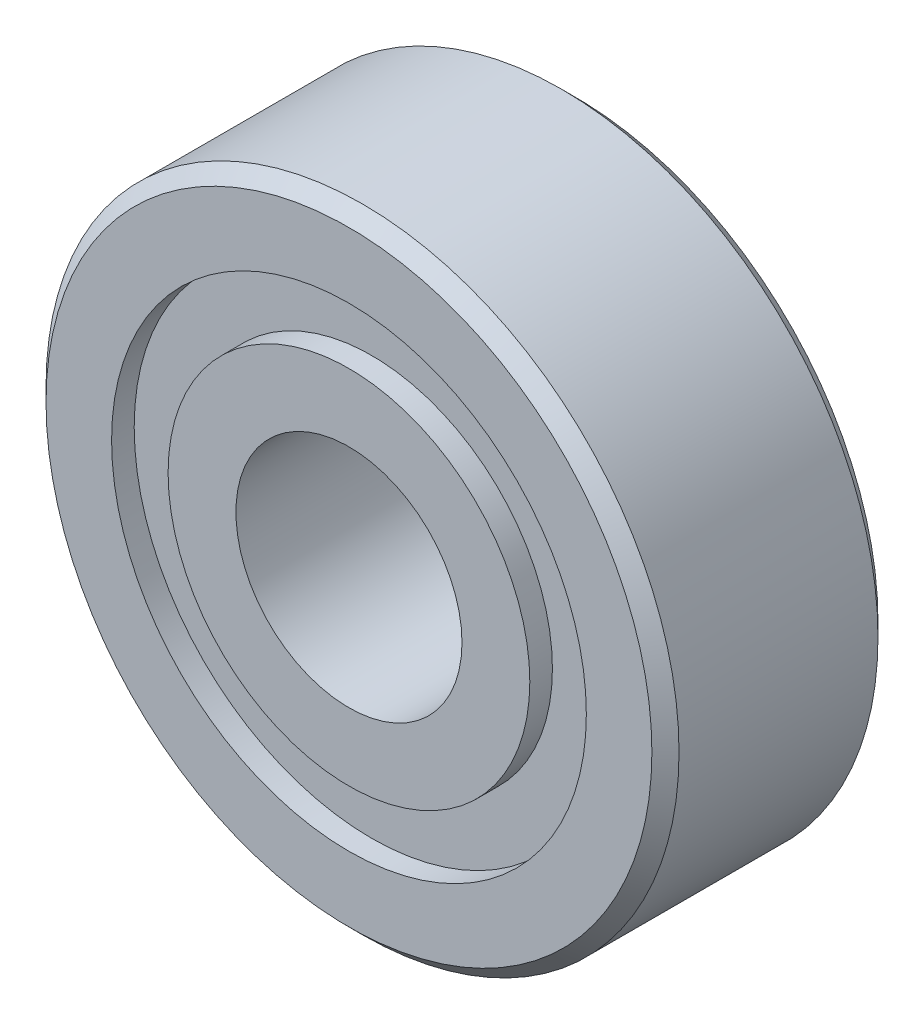
from build123d import *

# Parameters (mm, degrees)
SKETCH1_R           = 7
SKETCH1_R_2         = 2.5
BOSS_EXTRUDE1_DEPTH = 5
SKETCH2_R           = 5.25
SKETCH2_R_2         = 4
CUT_EXTRUDE1_DEPTH  = 0.5
CUT_EXTRUDE2_START  = -0.5
SKETCH3_R           = 5.25
SKETCH3_R_2         = 4
CUT_EXTRUDE2_DEPTH  = 0.5
CHAMFER1_SIZE       = 0.3


with BuildPart() as part:
    # Sketch1 → Boss-Extrude1 (new body)
    with BuildSketch(Plane.XY):
        Circle(SKETCH1_R)
        Circle(SKETCH1_R_2, mode=Mode.SUBTRACT)
    extrude(amount=BOSS_EXTRUDE1_DEPTH)

    # Sketch2 → Cut-Extrude1 (cut)
    with BuildSketch(Plane.XY.offset(5)):
        Circle(SKETCH2_R)
        Circle(SKETCH2_R_2, mode=Mode.SUBTRACT)
    extrude(amount=-CUT_EXTRUDE1_DEPTH, mode=Mode.SUBTRACT)

    # Sketch3 → Cut-Extrude2 (cut)
    with BuildSketch(Plane(origin=(0, 0, 0), x_dir=(-1, 0, 0), z_dir=(0, 0, -1)).offset(CUT_EXTRUDE2_START)):
        with Locations(Location((0, 0, 0), (0, 0, 180))):
            Circle(SKETCH3_R)
        with Locations(Location((0, 0, 0), (0, 0, 180))):
            Circle(SKETCH3_R_2, mode=Mode.SUBTRACT)
    extrude(amount=CUT_EXTRUDE2_DEPTH, mode=Mode.SUBTRACT)

    # Chamfer1
    chamfer1_edges = [part.edges().sort_by_distance(p)[0] for p in [
        (-7, 0, 0),
        (-7, 0, 5),
    ]]
    chamfer(chamfer1_edges, length=CHAMFER1_SIZE)


solid = part.part
